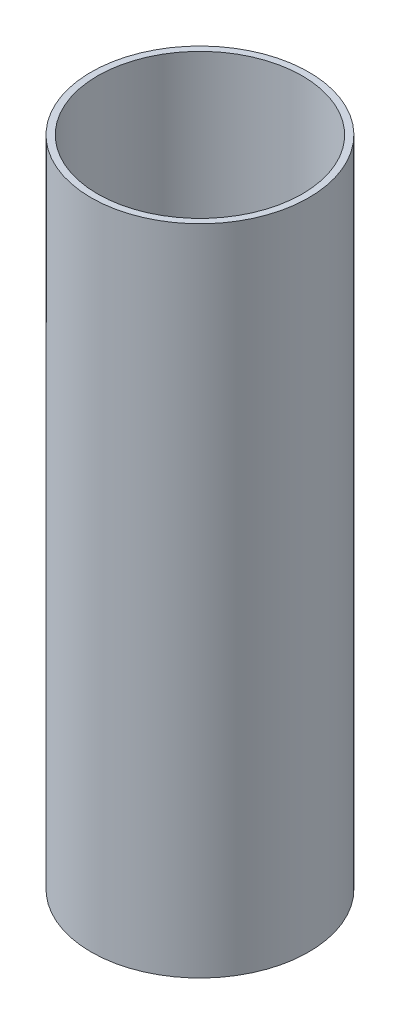
from build123d import *

# Parameters (mm, degrees)
SKETCH1_R           = 50
SKETCH1_R_2         = 47
BOSS_EXTRUDE1_DEPTH = 300


with BuildPart() as part:
    # Sketch1 → Boss-Extrude1 (new body)
    with BuildSketch(Plane(origin=(0, 0, 0), x_dir=(1, 0, 0), z_dir=(0, 1, 0))):
        with Locations(Location((0, 0, 0), (0, 0, 270))):
            Circle(SKETCH1_R)
        with Locations(Location((0, 0, 0), (0, 0, 270))):
            Circle(SKETCH1_R_2, mode=Mode.SUBTRACT)
    extrude(amount=BOSS_EXTRUDE1_DEPTH)


solid = part.part
